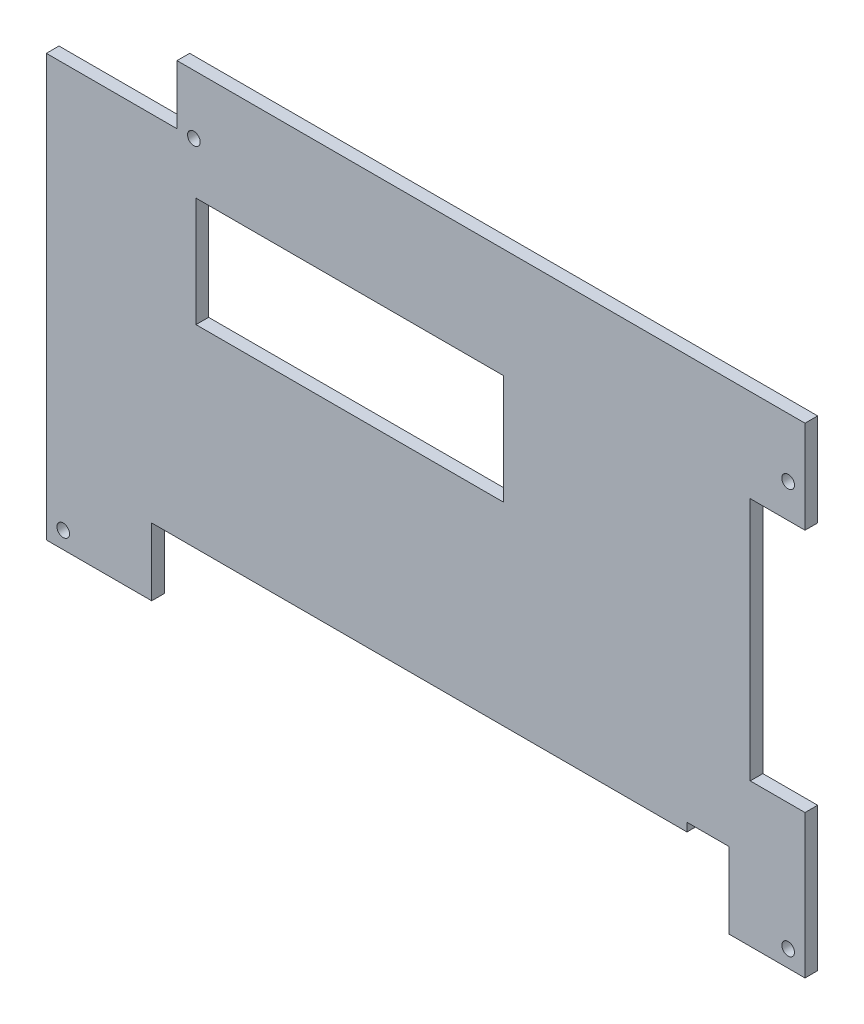
from build123d import *

# Parameters (mm, degrees)
SKETCH1_R           = 1.5
SKETCH1_W           = 73
SKETCH1_H           = 26
BOSS_EXTRUDE1_DEPTH = 3


with BuildPart() as part:
    # Sketch1 → Boss-Extrude1 (new body)
    with BuildSketch(Plane.XY):
        Polygon((-40, -91), (-15, -91), (-15, -75), (112, -75), (112, -73), (122, -73), (122, -91), (140, -91), (140, -57), (127, -57), (127, 1), (140, 1), (140, 23), (-9, 23), (-9, 9), (-40, 9), align=None)
        with Locations((-5, 9)):
            Circle(SKETCH1_R, mode=Mode.SUBTRACT)
        with Locations((136, 9)):
            Circle(SKETCH1_R, mode=Mode.SUBTRACT)
        with Locations((136, -87)):
            Circle(SKETCH1_R, mode=Mode.SUBTRACT)
        with Locations((-36, -87)):
            Circle(SKETCH1_R, mode=Mode.SUBTRACT)
        with Locations((32, -16)):
            Rectangle(SKETCH1_W, SKETCH1_H, mode=Mode.SUBTRACT)
    extrude(amount=-BOSS_EXTRUDE1_DEPTH)


solid = part.part
